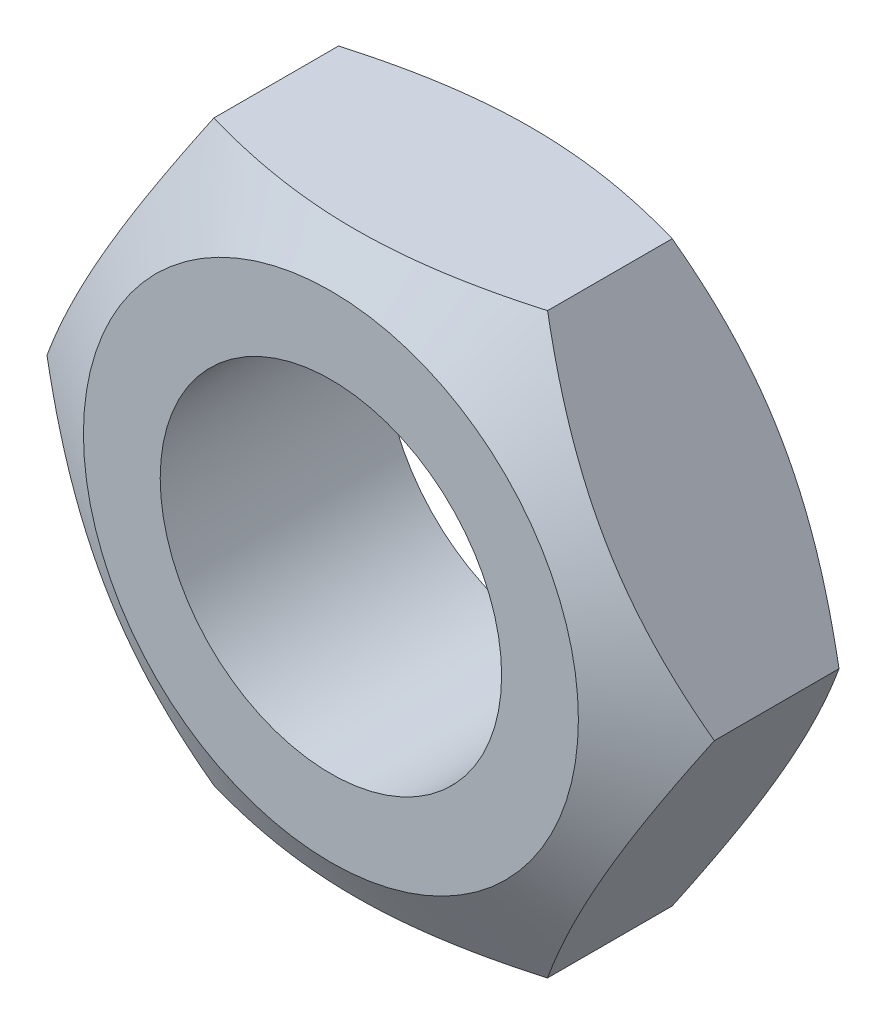
from build123d import *

# Parameters (mm, degrees)
BOSS_EXTRUDE1_DEPTH         = 5.5372
SKETCH6_OUTSIDE_W           = 68.81
SKETCH6_OUTSIDE_H           = 66.602
SKETCH6_OUTSIDE_R           = 6.112735428
CUT_EXTRUDE4_DEPTH          = 13.228781918
CUT_EXTRUDE4_DRAFT          = -60
MIRROR1_COPY_1_SKETCH_W     = 68.81
MIRROR1_COPY_1_SKETCH_H     = 66.602
MIRROR1_COPY_1_SKETCH_R     = 6.112735428
MIRROR1_COPY_1_DEPTH        = 13.228781918
MIRROR1_COPY_1_DRAFT        = -60
F_3_8_24_TAPPED_HOLE1_D     = 8.4328
F_3_8_24_TAPPED_HOLE1_DEPTH = 24.384
F_3_8_24_TAPPED_HOLE1_TIP   = 2.533468714


with BuildPart() as part:
    # Sketch1 → Boss-Extrude1 (new body)
    with BuildSketch(Plane.XY):
        Polygon((4.121592226, 7.1374), (-4.120373604, 7.138103572), (-8.24196583, 0.000703572), (-4.121592226, -7.1374), (4.120373604, -7.138103572), (8.24196583, -0.000703572), align=None)
    extrude(amount=BOSS_EXTRUDE1_DEPTH)


with BuildPart() as cut_extrude4_tool:
    # Sketch6 outside → Cut-Extrude4 (with draft: the straight prism first)
    with BuildSketch(Plane(origin=(0, 0, 0), x_dir=(-1, 0, 0), z_dir=(0, 0, -1))):
        Rectangle(SKETCH6_OUTSIDE_W, SKETCH6_OUTSIDE_H)
        Circle(SKETCH6_OUTSIDE_R, mode=Mode.SUBTRACT)
    extrude(amount=-CUT_EXTRUDE4_DEPTH)
    # Cut-Extrude4: the draft: its side faces are tilted about the plane it starts from
    cut_extrude4_sides = [cut_extrude4_tool.faces().sort_by_distance(p)[0] for p in [
        (0, -33.301, 6.614390959),
        (-34.405, 0, 6.614390959),
        (0, 33.301, 6.614390959),
        (34.405, 0, 6.614390959),
        (6.112735428, 0, 6.614390959),
    ]]
    draft(cut_extrude4_sides, Plane(origin=(0, 0, 0), x_dir=(-1, 0, 0), z_dir=(0, 0, -1)), CUT_EXTRUDE4_DRAFT)


with BuildPart() as part_1:
    add(part.part)

    # Cut-Extrude4: cut by cut_extrude4_tool
    add(cut_extrude4_tool.part, mode=Mode.SUBTRACT)


with BuildPart() as mirror1_copy_1_tool:
    # Mirror1 copy 1 sketch → Mirror1 copy 1 (with draft: the straight prism first)
    with BuildSketch(Plane(origin=(0, 0, 5.5372), x_dir=(-1, 0, 0), z_dir=(0, 0, 1))):
        Rectangle(MIRROR1_COPY_1_SKETCH_W, MIRROR1_COPY_1_SKETCH_H)
        Circle(MIRROR1_COPY_1_SKETCH_R, mode=Mode.SUBTRACT)
    extrude(amount=-MIRROR1_COPY_1_DEPTH)
    # Mirror1 copy 1: the draft: its side faces are tilted about the plane it starts from
    mirror1_copy_1_sides = [mirror1_copy_1_tool.faces().sort_by_distance(p)[0] for p in [
        (0, -33.301, -1.077190959),
        (-34.405, 0, -1.077190959),
        (0, 33.301, -1.077190959),
        (34.405, 0, -1.077190959),
        (6.112735428, 0, -1.077190959),
    ]]
    draft(mirror1_copy_1_sides, Plane(origin=(0, 0, 5.5372), x_dir=(-1, 0, 0), z_dir=(0, 0, 1)), MIRROR1_COPY_1_DRAFT)


with BuildPart() as part_2:
    add(part_1.part)

    # Mirror1 copy 1: cut by mirror1_copy_1_tool
    add(mirror1_copy_1_tool.part, mode=Mode.SUBTRACT)

    # 3/8-24 Tapped Hole1
    with Locations(Plane.XY.offset(5.5372)):
        with Locations((0, 0)):
            Hole(F_3_8_24_TAPPED_HOLE1_D / 2, depth=F_3_8_24_TAPPED_HOLE1_DEPTH)
            with Locations((0, 0, -(F_3_8_24_TAPPED_HOLE1_DEPTH + F_3_8_24_TAPPED_HOLE1_TIP / 2))):  # 118° drill point
                Cone(0, F_3_8_24_TAPPED_HOLE1_D / 2, F_3_8_24_TAPPED_HOLE1_TIP, mode=Mode.SUBTRACT)


solid = part_2.part
